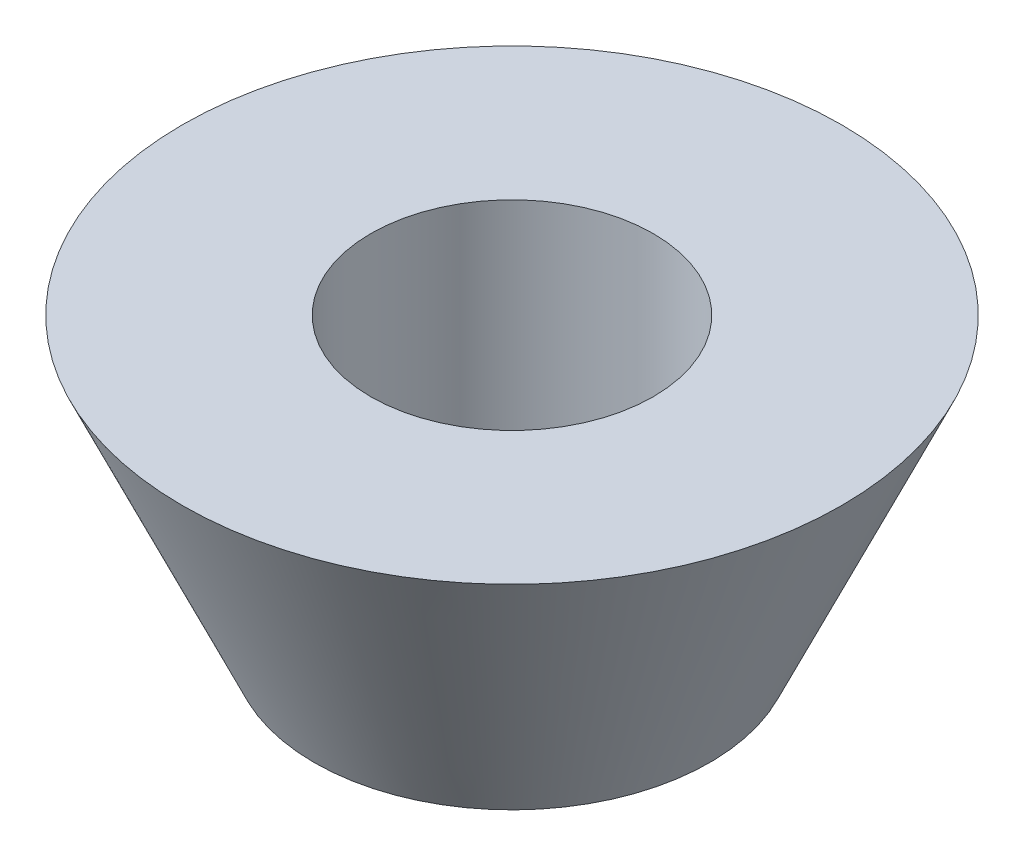
from build123d import *


with BuildPart() as part:
    # Sketch2 → Revolve1 (revolve)
    with BuildSketch(Plane.XY, mode=Mode.PRIVATE) as revolve1_sk:
        Polygon((4.7625, 18.772308679), (4.7625, 9.045378679), (6.6675, 9.045378679), (11.1125, 18.772308679), align=None)
    revolve(revolve1_sk.sketch.rotate(Axis((0, 55, 0), (0, -1, 0)), 90), axis=Axis((0, 55, 0), (0, -1, 0)))


solid = part.part
